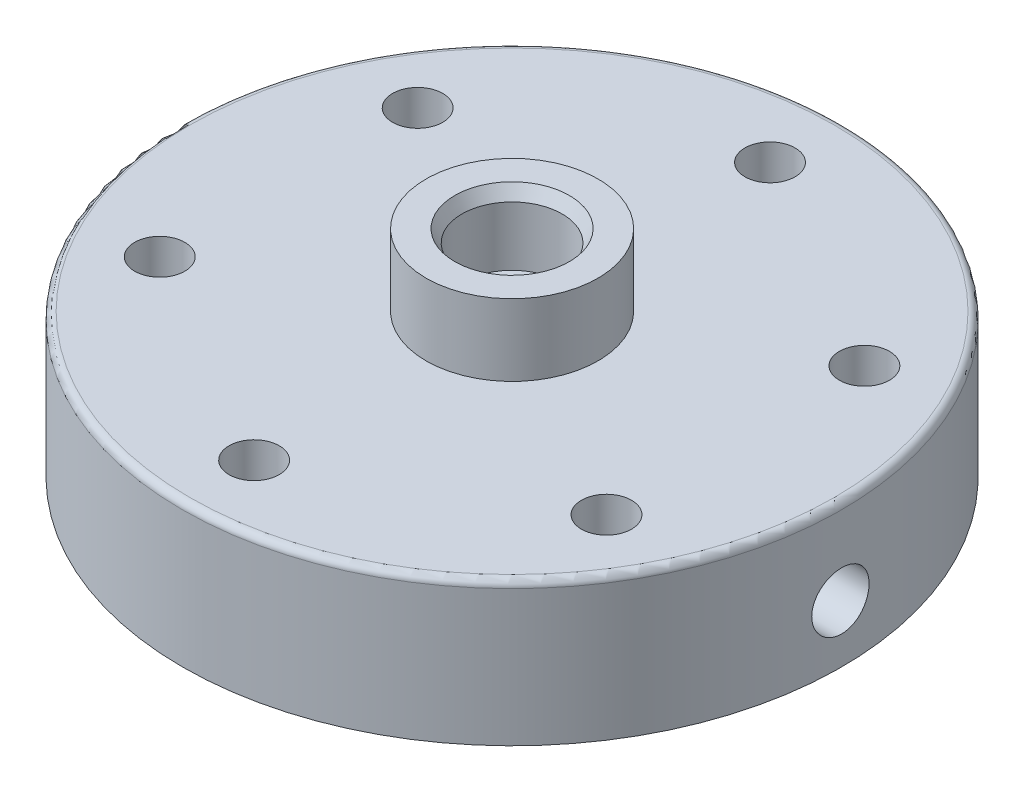
from build123d import *

# Parameters (mm, degrees)
SKETCH1_R           = 46
SKETCH1_R_2         = 3.5
BOSS_EXTRUDE1_DEPTH = 20
FILLET1_R           = 1
SKETCH2_R           = 12
BOSS_EXTRUDE2_DEPTH = 10
SKETCH3_R           = 33
CUT_EXTRUDE1_DEPTH  = 14
SKETCH4_R           = 2.5
CUT_EXTRUDE2_DEPTH  = 6
SKETCH5_R           = 7
CUT_EXTRUDE3_DEPTH  = 10
CHAMFER1_SIZE       = 1
CHAMFER1_SIZE2      = 1.732050808
SKETCH6_R           = 4
CUT_EXTRUDE4_DEPTH  = 80


with BuildPart() as part:
    # Sketch1 → Boss-Extrude1 (new body)
    with BuildSketch(Plane(origin=(0, 0, 0), x_dir=(1, 0, 0), z_dir=(0, 1, 0))):
        with Locations(Location((0, 0, 0), (0, 0, 270))):
            Circle(SKETCH1_R)
        with Locations(Location((0, 36, 0), (0, 0, 270))):
            Circle(SKETCH1_R_2, mode=Mode.SUBTRACT)
        with Locations(Location((31.176914536, 18, 0), (0, 0, 270))):
            Circle(SKETCH1_R_2, mode=Mode.SUBTRACT)
        with Locations(Location((31.176914536, -18, 0), (0, 0, 270))):
            Circle(SKETCH1_R_2, mode=Mode.SUBTRACT)
        with Locations(Location((0, -36, 0), (0, 0, 270))):
            Circle(SKETCH1_R_2, mode=Mode.SUBTRACT)
        with Locations(Location((-31.176914536, -18, 0), (0, 0, 270))):
            Circle(SKETCH1_R_2, mode=Mode.SUBTRACT)
        with Locations(Location((-31.176914536, 18, 0), (0, 0, 270))):
            Circle(SKETCH1_R_2, mode=Mode.SUBTRACT)
    extrude(amount=BOSS_EXTRUDE1_DEPTH)

    # Fillet1
    fillet1_edges = [part.edges().sort_by_distance(p)[0] for p in [
        (0, 20, -46),
    ]]
    fillet(fillet1_edges, radius=FILLET1_R)

    # Sketch2 → Boss-Extrude2 (add)
    with BuildSketch(Plane(origin=(0, 20, 0), x_dir=(1, 0, 0), z_dir=(0, 1, 0))):
        with Locations(Location((0, 0, 0), (0, 0, 270))):
            Circle(SKETCH2_R)
    extrude(amount=BOSS_EXTRUDE2_DEPTH)

    # Sketch3 → Cut-Extrude1 (cut)
    with BuildSketch(Plane.XZ):
        Circle(SKETCH3_R)
    extrude(amount=-CUT_EXTRUDE1_DEPTH, mode=Mode.SUBTRACT)

    # Sketch4 → Cut-Extrude2 (cut)
    with BuildSketch(Plane.XZ.offset(-14)):
        with Locations(Location((0, 0, 0), (0, 0, 270))):
            Circle(SKETCH4_R)
    extrude(amount=-CUT_EXTRUDE2_DEPTH, mode=Mode.SUBTRACT)

    # Sketch5 → Cut-Extrude3 (cut)
    with BuildSketch(Plane(origin=(0, 30, 0), x_dir=(1, 0, 0), z_dir=(0, 1, 0))):
        with Locations(Location((0, 0, 0), (0, 0, 270))):
            Circle(SKETCH5_R)
    extrude(amount=-CUT_EXTRUDE3_DEPTH, mode=Mode.SUBTRACT)

    # Chamfer1
    chamfer1_edges = [part.edges().sort_by_distance(p)[0] for p in [
        (0, 30, -7),
    ]]
    chamfer1_side = [part.faces().sort_by_distance(p)[0] for p in [
        (0, 30, -11.660588745),
    ]]
    chamfer(chamfer1_edges, length=CHAMFER1_SIZE, length2=CHAMFER1_SIZE2, reference=chamfer1_side[0])

    # Sketch6 → Cut-Extrude4 (cut)
    with BuildSketch(Plane(origin=(0, 0, 0), x_dir=(0, 0, -1), z_dir=(1, 0, 0))):
        with Locations(Location((0, 8, 0), (0, 0, 180))):
            Circle(SKETCH6_R)
    extrude(amount=CUT_EXTRUDE4_DEPTH, mode=Mode.SUBTRACT)


solid = part.part
